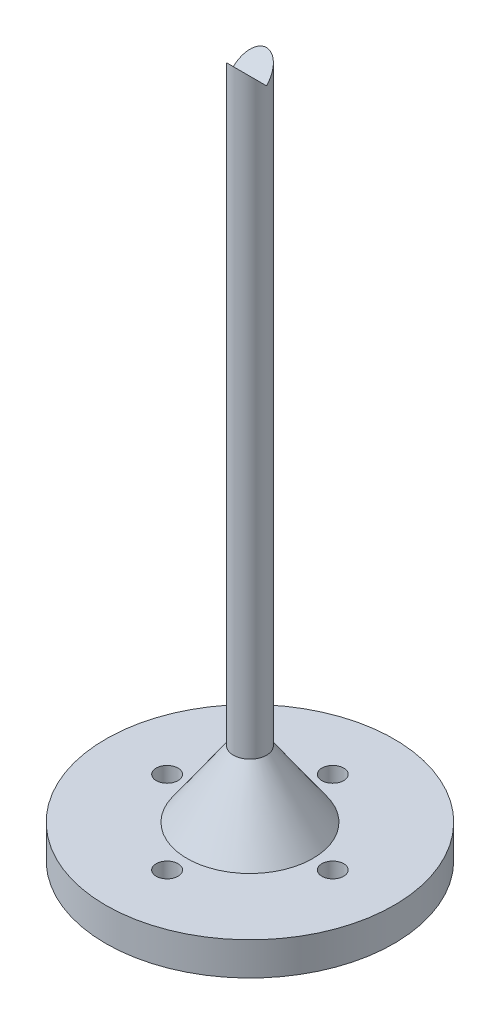
from build123d import *

# Parameters (mm, degrees)
SKETCH1_R                = 43.5
BOSS_EXTRUDE4_DEPTH      = 10
HOLE_WIZARD_M6_2_D       = 6.6
CIRPATTERN1_COUNT        = 4
SKETCH20_R               = 5
BOSS_EXTRUDE6_DEPTH      = 200
CUT_EXTRUDE_1_DEPTH      = 10
CUT_EXTRUDE_1_DEPTH_BACK = 10
CHAMFER_1_SIZE           = 14
CHAMFER_1_SIZE2          = 19.994072094


with BuildPart() as part:
    # Sketch1 → Boss-Extrude4 (new body)
    with BuildSketch(Plane(origin=(0, 0, 0), x_dir=(1, 0, 0), z_dir=(0, 1, 0))):
        Circle(SKETCH1_R)
    extrude(amount=BOSS_EXTRUDE4_DEPTH)

    # M6 여유 구멍2 (through all)
    with Locations(Plane(origin=(0, 10, 0), x_dir=(1, 0, 0), z_dir=(0, 1, 0))):
        with Locations((0, -25)):
            hole_wizard_m6_2 = Hole(HOLE_WIZARD_M6_2_D / 2)

    # CirPattern1: M6 여유 구멍2 ×4 about axis
    cirpattern1_axis = Axis((0, 10, 0), (0, -1, 0))
    for i in range(1, CIRPATTERN1_COUNT):
        add(hole_wizard_m6_2.rotate(cirpattern1_axis, i * 360 / CIRPATTERN1_COUNT), mode=Mode.SUBTRACT)

    # Sketch20 → Boss-Extrude6 (add)
    with BuildSketch(Plane(origin=(0, 10, 0), x_dir=(1, 0, 0), z_dir=(0, 1, 0))):
        Circle(SKETCH20_R)
    extrude(amount=BOSS_EXTRUDE6_DEPTH)

    # 스케치12 → 컷-돌출1 (cut, two sides: drawn at the far end of the back side and taken through both)
    with BuildSketch(Plane(origin=(0, 0, 0), x_dir=(0, 0, -1), z_dir=(1, 0, 0)).offset(-CUT_EXTRUDE_1_DEPTH_BACK)):
        Polygon((-5, 210), (5, 210), (0, 205), align=None)
    extrude(amount=CUT_EXTRUDE_1_DEPTH + CUT_EXTRUDE_1_DEPTH_BACK, mode=Mode.SUBTRACT)

    # 모따기1
    chamfer_1_edges = [part.edges().sort_by_distance(p)[0] for p in [
        (-5, 10, 0),
    ]]
    chamfer_1_side = [part.faces().sort_by_distance(p)[0] for p in [
        (-42.269634201, 10, 0),
    ]]
    chamfer(chamfer_1_edges, length=CHAMFER_1_SIZE, length2=CHAMFER_1_SIZE2, reference=chamfer_1_side[0])


solid = part.part
